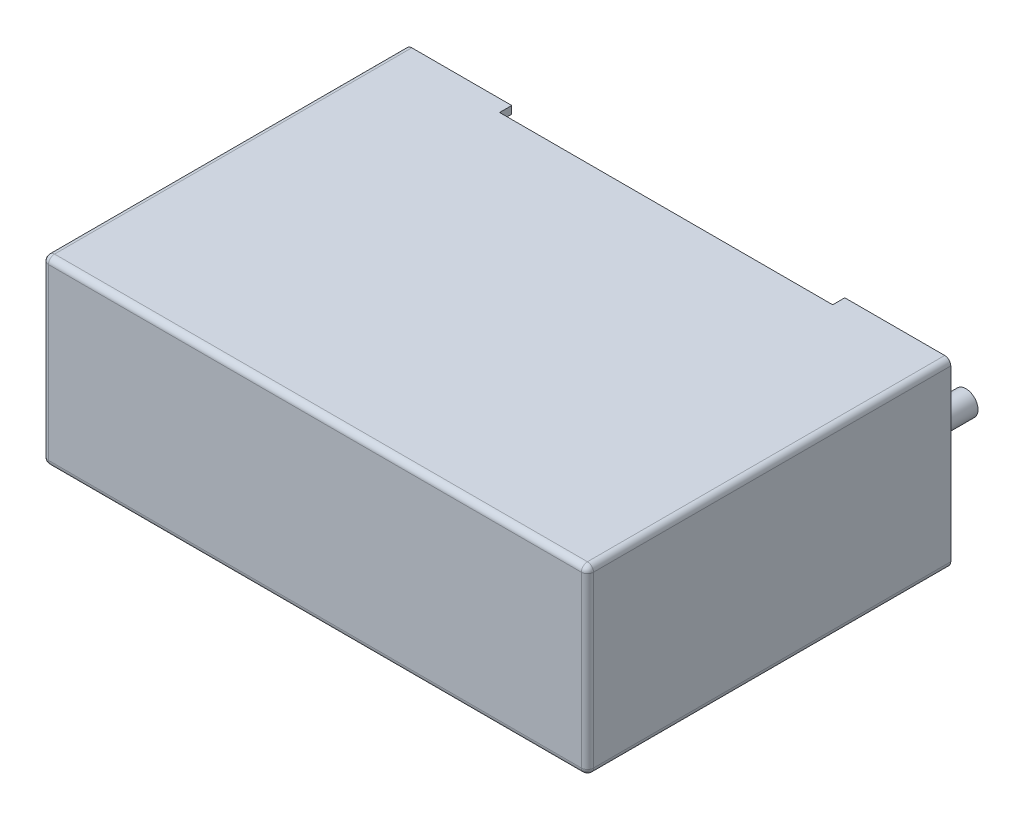
from build123d import *

# Parameters (mm, degrees)
SKETCH1_W               = 18
SKETCH1_H               = 6
EXTRUDE1_DEPTH          = 12
FILLET1_R               = 0.2
BOSS_EXTRUDE1_DEPTH     = 0.01
SKETCH4_W               = 17.5
SKETCH4_H               = 5.5
CUT_EXTRUDE1_DEPTH      = 0.5
CUT_EXTRUDE5_DEPTH      = 17.155494421
CUT_EXTRUDE5_DEPTH_BACK = 6
SKETCH5_W               = 11
SKETCH5_H               = 0.4
SKETCH2_R               = 0.4
EXTRUDE2_DEPTH          = 2.5


with BuildPart() as part:
    # Sketch1 → Extrude1 (new body)
    with BuildSketch(Plane.XY):
        Rectangle(SKETCH1_W, SKETCH1_H)
    extrude(amount=EXTRUDE1_DEPTH)

    # Fillet1
    fillet1_edges = [part.edges().sort_by_distance(p)[0] for p in [
        (9, 0, 12),
        (0, 3, 12),
        (-9, 0, 12),
        (0, -3, 12),
        (-9, 3, 6),
        (9, 3, 6),
        (9, -3, 6),
        (-9, -3, 6),
    ]]
    fillet(fillet1_edges, radius=FILLET1_R)

    # Sketch3 → Boss-Extrude1 (add)
    # profile 1 of 16: a face of its own
    with BuildSketch(Plane.XZ.offset(3)):
        Polygon((-4.080689103, 8.504062122), (-3.871121294, 10.091562122), (-3.85076873, 10.091562122), (-3.195352564, 8.78899802), (-2.541526442, 10.091562122), (-2.520855869, 10.091562122), (-2.310016026, 8.504062122), (-2.453119992, 8.504062122), (-2.605128205, 9.646349782), (-3.178180088, 8.504062122), (-3.210298978, 8.504062122), (-3.785576923, 9.648893853), (-3.937267127, 8.504062122), align=None)
    # profile 2 of 16: a face of its own
    with BuildSketch(Plane.XZ.offset(3)):
        Polygon((-1.984375, 10.091562122), (-1.841907051, 10.091562122), (-1.841907051, 9.487027367), (-1.180130709, 10.091562122), (-0.976923077, 10.091562122), (-1.756998698, 9.379222379), (-0.915865385, 8.504062122), (-1.105716647, 8.504062122), (-1.841907051, 9.270145355), (-1.841907051, 8.504062122), (-1.984375, 8.504062122), align=None)
    # profile 3 of 16: a face of its own
    with BuildSketch(Plane.XZ.offset(3)):
        with BuildLine():
            Line((-0.681810897, 10.091562122), (-0.370480268, 10.091562122))
            add(Edge.make_bspline(
                [(-0.370480268, 10.091562122), (-0.34906675, 10.091538583), (-0.308037499, 10.091493482), (-0.249202455, 10.09012608), (-0.195767327, 10.088299687), (-0.147847333, 10.0857679), (-0.105295031, 10.082775875), (-0.06830297, 10.078579414), (-0.036580386, 10.07419778), (-0.017572818, 10.069743071), (-0.008904247, 10.067711461)],
                knots=[0, 0, 0, 0, 1.415646017, 2.712440637, 3.8905458, 4.950247383, 5.884950622, 6.709939814, 7.411656543, 8, 8, 8, 8], degree=3))
            add(Edge.make_bspline(
                [(-0.008904247, 10.067711461), (0.002069249, 10.064707934), (0.023757664, 10.058771654), (0.055009208, 10.046881858), (0.084742559, 10.032783876), (0.113059731, 10.016716589), (0.139612747, 9.997990636), (0.164797773, 9.977365103), (0.188392549, 9.954363784), (0.210264395, 9.929244663), (0.230350714, 9.902429425), (0.247645249, 9.87351777), (0.262126526, 9.842996358), (0.274546796, 9.810886416), (0.283485988, 9.776918305), (0.290220117, 9.741328047), (0.294494406, 9.704119455), (0.294903782, 9.678692301), (0.295112179, 9.66574832)],
                knots=[0, 0, 0, 0, 0.999701418, 1.975846123, 2.934577507, 3.890451536, 4.834027766, 5.787354733, 6.749476667, 7.726910423, 8.712836071, 9.690891519, 10.682875813, 11.679750201, 12.712814741, 13.765529915, 14.8625177, 16, 16, 16, 16], degree=3))
            add(Edge.make_bspline(
                [(0.295112179, 9.66574832), (0.294921033, 9.652695543), (0.294547043, 9.627156902), (0.290058371, 9.589794959), (0.284012176, 9.554090546), (0.274715299, 9.520122831), (0.262538869, 9.488093535), (0.248254973, 9.457513191), (0.231026729, 9.428902054), (0.211230682, 9.402156254), (0.189209066, 9.377250687), (0.165055054, 9.354365834), (0.138866161, 9.333635652), (0.110725615, 9.315013667), (0.080359077, 9.298931712), (0.0482271, 9.284527506), (0.014050395, 9.272430275), (-0.00959996, 9.26606664), (-0.021624599, 9.262831153)],
                knots=[0, 0, 0, 0, 1.121902311, 2.195077645, 3.232258892, 4.234102512, 5.217864754, 6.176164875, 7.132989551, 8.084763148, 9.034132444, 9.988522005, 10.94243251, 11.903244335, 12.886203696, 13.894208494, 14.929344452, 16, 16, 16, 16], degree=3))
            add(Edge.make_bspline(
                [(-0.021624599, 9.262831153), (-0.031570212, 9.260716158), (-0.053366599, 9.256081023), (-0.089263477, 9.250906473), (-0.131057991, 9.246489776), (-0.178693096, 9.243178188), (-0.232126035, 9.2403432), (-0.291385713, 9.238089814), (-0.356588455, 9.23685163), (-0.402068626, 9.236787771), (-0.425813802, 9.23675443)],
                knots=[0, 0, 0, 0, 0.601384939, 1.31797006, 2.144135048, 3.087295005, 4.142315834, 5.309527816, 6.595305764, 8, 8, 8, 8], degree=3))
            Line((-0.425813802, 9.23675443), (-0.539342949, 9.23675443))
            Line((-0.539342949, 9.23675443), (-0.539342949, 8.504062122))
            Line((-0.539342949, 8.504062122), (-0.681810897, 8.504062122))
            Line((-0.681810897, 8.504062122), (-0.681810897, 10.091562122))
        make_face()
        with BuildLine():
            Line((-0.539342949, 9.928741609), (-0.539342949, 9.399574943))
            Line((-0.539342949, 9.399574943), (-0.261403245, 9.396076846))
            add(Edge.make_bspline(
                [(-0.261403245, 9.396076846), (-0.247832422, 9.396069832), (-0.221634227, 9.396056292), (-0.18378994, 9.397863875), (-0.148679299, 9.399950545), (-0.116410152, 9.403005768), (-0.086967953, 9.407324338), (-0.06030361, 9.411683948), (-0.036623878, 9.417991023), (-0.008911026, 9.426483272), (0.021969636, 9.440966994), (0.055564559, 9.46198998), (0.084035504, 9.488787301), (0.108672731, 9.518917068), (0.128224326, 9.552435602), (0.142537222, 9.588299012), (0.150946962, 9.626139501), (0.152074628, 9.65203305), (0.152644231, 9.665112302)],
                knots=[0, 0, 0, 0, 1.160613943, 2.240541288, 3.23993089, 4.169200891, 5.011653406, 5.7853311, 6.478053781, 7.106038997, 8.262395093, 9.384106736, 10.481365981, 11.59014053, 12.70357646, 13.786202915, 14.881775077, 16, 16, 16, 16], degree=3))
            add(Edge.make_bspline(
                [(0.152644231, 9.665112302), (0.15207153, 9.677875128), (0.150933073, 9.703246046), (0.142471306, 9.74042927), (0.128252153, 9.77591475), (0.108541484, 9.809013256), (0.084619614, 9.839034607), (0.056815983, 9.865113661), (0.02519604, 9.886078505), (-0.004217265, 9.899610029), (-0.030343517, 9.907871957), (-0.053036585, 9.913652653), (-0.078659141, 9.918268017), (-0.107219526, 9.92200522), (-0.138496376, 9.925204469), (-0.172758397, 9.927375251), (-0.2098758, 9.928645912), (-0.235643452, 9.928708938), (-0.249000901, 9.928741609)],
                knots=[0, 0, 0, 0, 1.120700087, 2.227813068, 3.331159281, 4.466773991, 5.599788987, 6.693661531, 7.80175334, 8.91857717, 9.525282508, 10.207424825, 10.974604443, 11.810962634, 12.737642355, 13.736264703, 14.826523623, 16, 16, 16, 16], degree=3))
            Line((-0.249000901, 9.928741609), (-0.539342949, 9.928741609))
        make_face(mode=Mode.SUBTRACT)
    # profile 4 of 16: a face of its own
    with BuildSketch(Plane.XZ.offset(3)):
        Polygon((1.119391026, 10.091562122), (1.283801583, 10.091562122), (1.699439103, 9.442188124), (2.115076623, 10.091562122), (2.279487179, 10.091562122), (1.781803385, 9.313712563), (2.299839744, 8.504062122), (2.135429187, 8.504062122), (1.699439103, 9.185237002), (1.263449018, 8.504062122), (1.099038462, 8.504062122), (1.617392829, 9.313712563), align=None)
    # profile 5 of 16: a face of its own
    with BuildSketch(Plane.XZ.offset(3)):
        with BuildLine():
            Line((2.635657051, 9.603100584), (2.493189103, 9.603100584))
            add(Edge.make_bspline(
                [(2.493189103, 9.603100584), (2.494117633, 9.622001308), (2.495941241, 9.659121827), (2.504481215, 9.713243742), (2.516700827, 9.76497574), (2.533978023, 9.813902451), (2.555434799, 9.860456481), (2.581165918, 9.904452917), (2.611643129, 9.94572392), (2.646208326, 9.983886895), (2.683749816, 10.018896972), (2.724256438, 10.049129886), (2.766821862, 10.074673973), (2.811316946, 10.096028679), (2.858243702, 10.112057823), (2.907176284, 10.12395121), (2.958329678, 10.131106909), (2.993182116, 10.131876069), (3.010907452, 10.13226725)],
                knots=[0, 0, 0, 0, 1.10065271, 2.161652631, 3.183658789, 4.190468796, 5.17591951, 6.163126047, 7.15150782, 8.156236427, 9.156009102, 10.134482811, 11.092018607, 12.041330605, 13.001268258, 13.972401359, 14.968799086, 16, 16, 16, 16], degree=3))
            add(Edge.make_bspline(
                [(3.010907452, 10.13226725), (3.02831465, 10.131859736), (3.062519172, 10.131058985), (3.112440157, 10.124182376), (3.159964144, 10.113412054), (3.204998238, 10.098301133), (3.247183132, 10.077988196), (3.286835727, 10.05358717), (3.324428095, 10.025366032), (3.3582676, 9.992140195), (3.389340908, 9.956669828), (3.416148002, 9.9188021), (3.439104687, 9.87969096), (3.458239813, 9.839038168), (3.47232599, 9.796460952), (3.483020392, 9.752579185), (3.489065326, 9.706938646), (3.489993071, 9.676047458), (3.490464744, 9.66034217)],
                knots=[0, 0, 0, 0, 1.111607364, 2.184268762, 3.212621178, 4.221274766, 5.211760367, 6.196651075, 7.1921475, 8.207485113, 9.220403448, 10.201281604, 11.166441695, 12.114753415, 13.065576456, 14.026450734, 14.996634279, 16, 16, 16, 16], degree=3))
            add(Edge.make_bspline(
                [(3.490464744, 9.66034217), (3.489696728, 9.638231545), (3.488174174, 9.594398305), (3.475150153, 9.529984421), (3.454809057, 9.467575978), (3.430317399, 9.417348701), (3.405610255, 9.376874938), (3.383345564, 9.343551633), (3.357281167, 9.307671652), (3.327037706, 9.269355146), (3.293240796, 9.228301985), (3.255584315, 9.184536971), (3.213799735, 9.138512275), (3.184472487, 9.107077235), (3.169275841, 9.090788384)],
                knots=[0, 0, 0, 0, 1.184426356, 2.348067706, 3.509069118, 4.696110526, 5.333549288, 6.050745305, 6.844228056, 7.710549037, 8.667450064, 9.695053472, 10.805634456, 12, 12, 12, 12], degree=3))
            Line((3.169275841, 9.090788384), (2.772082833, 8.666882635))
            Line((2.772082833, 8.666882635), (3.510817308, 8.666882635))
            Line((3.510817308, 8.666882635), (3.510817308, 8.504062122))
            Line((3.510817308, 8.504062122), (2.43213141, 8.504062122))
            Line((2.43213141, 8.504062122), (3.047796474, 9.161068332))
            add(Edge.make_bspline(
                [(3.047796474, 9.161068332), (3.062786052, 9.176715778), (3.091577962, 9.20677132), (3.132300773, 9.250651163), (3.168876314, 9.29135899), (3.201541346, 9.328817889), (3.229587258, 9.363575779), (3.254475734, 9.394506948), (3.27441727, 9.422970573), (3.29605961, 9.455963637), (3.317020952, 9.496246367), (3.335033342, 9.545474148), (3.346016505, 9.596150437), (3.347334056, 9.630396004), (3.347996795, 9.647621818)],
                knots=[0, 0, 0, 0, 1.329631726, 2.553950428, 3.673215718, 4.687767853, 5.603093632, 6.413772471, 7.123043292, 7.734684054, 8.834405432, 9.900288307, 10.943827018, 12, 12, 12, 12], degree=3))
            add(Edge.make_bspline(
                [(3.347996795, 9.647621818), (3.34770844, 9.658453738), (3.347140149, 9.679801372), (3.342124693, 9.711100413), (3.334545285, 9.74129231), (3.3236844, 9.770469934), (3.309348486, 9.798339926), (3.29189806, 9.824936212), (3.271763996, 9.850648707), (3.248472527, 9.874757524), (3.222885873, 9.896837928), (3.195855624, 9.916397781), (3.167257899, 9.932744092), (3.137213272, 9.946144178), (3.105805505, 9.956655869), (3.072973853, 9.963939582), (3.038809031, 9.968512708), (3.015480267, 9.969131458), (3.003593249, 9.969446738)],
                knots=[0, 0, 0, 0, 0.991446411, 1.95395049, 2.89581595, 3.838931463, 4.798493298, 5.75982156, 6.748411868, 7.785213223, 8.824556874, 9.840280684, 10.836137867, 11.835679398, 12.848801643, 13.863922112, 14.911575587, 16, 16, 16, 16], degree=3))
            add(Edge.make_bspline(
                [(3.003593249, 9.969446738), (2.991178621, 9.969122419), (2.966798342, 9.968485512), (2.931002924, 9.964030232), (2.896855446, 9.956344083), (2.864270012, 9.945831806), (2.833191485, 9.93247025), (2.803771008, 9.915827923), (2.776074626, 9.895968981), (2.750050275, 9.873453443), (2.726072684, 9.848385638), (2.705005708, 9.820441119), (2.686597959, 9.790130113), (2.670537342, 9.757534406), (2.657494583, 9.722358227), (2.64752819, 9.684726447), (2.639642013, 9.644802463), (2.637007434, 9.617232085), (2.635657051, 9.603100584)],
                knots=[0, 0, 0, 0, 1.031018746, 2.02475058, 2.990194455, 3.934040569, 4.864654155, 5.795059489, 6.735614925, 7.690564532, 8.649604399, 9.611025574, 10.590972636, 11.591080095, 12.624614302, 13.701020113, 14.821632451, 16, 16, 16, 16], degree=3))
        make_face()
    # profile 6 of 16: a face of its own
    with BuildSketch(Plane.XZ.offset(3)):
        Polygon((-2.939355469, 6.445728789), (-2.645833333, 6.445728789), (-2.645833333, 4.858228789), (-2.788301282, 4.858228789), (-2.788301282, 6.282908276), (-3.032532051, 6.282908276), align=None)
    # profile 7 of 16: a face of its own
    with BuildSketch(Plane.XZ.offset(3)):
        with BuildLine():
            add(Edge.make_bspline(
                [(-2.055608974, 5.651342771), (-2.055460195, 5.676786943), (-2.055171188, 5.726212615), (-2.051956083, 5.798232792), (-2.046615124, 5.865796923), (-2.039295673, 5.928908242), (-2.030388446, 5.987583042), (-2.01849785, 6.041664522), (-2.004975615, 6.091402986), (-1.989303613, 6.136960629), (-1.971619865, 6.17895123), (-1.952372897, 6.218151232), (-1.930798865, 6.254501323), (-1.908130766, 6.288581678), (-1.883451005, 6.319834425), (-1.85746191, 6.348700919), (-1.829149131, 6.374514009), (-1.799475123, 6.398030011), (-1.768171227, 6.418644592), (-1.736129732, 6.436802299), (-1.703130095, 6.452314382), (-1.669082219, 6.464511115), (-1.63429213, 6.47458532), (-1.598638211, 6.481474593), (-1.562061592, 6.485809334), (-1.537373048, 6.486223747), (-1.524852264, 6.486433917)],
                knots=[0, 0, 0, 0, 1.646270934, 3.197905019, 4.663502075, 6.030701355, 7.308322542, 8.50163776, 9.611534131, 10.641858119, 11.616356847, 12.558055219, 13.465016945, 14.349605745, 15.204443733, 16.039544428, 16.859896111, 17.680448484, 18.487036065, 19.28249412, 20.06191084, 20.843045899, 21.620316918, 22.403196591, 23.190181807, 24, 24, 24, 24], degree=3))
            add(Edge.make_bspline(
                [(-1.524852264, 6.486433917), (-1.512226886, 6.486212658), (-1.487118982, 6.485772643), (-1.449998526, 6.481543569), (-1.413735635, 6.47452631), (-1.378484907, 6.464583582), (-1.343956789, 6.4522484), (-1.310421346, 6.436787458), (-1.277670277, 6.418790257), (-1.24622404, 6.397642999), (-1.215737411, 6.374065324), (-1.186959227, 6.347412256), (-1.159886871, 6.317952919), (-1.134180571, 6.286002502), (-1.11056964, 6.250948196), (-1.088084547, 6.213399689), (-1.06795866, 6.172700332), (-1.048575432, 6.129529192), (-1.031844549, 6.082691746), (-1.01675593, 6.032452016), (-1.004564398, 5.978216581), (-0.994409264, 5.920269998), (-0.986542115, 5.858399461), (-0.980812309, 5.792737597), (-0.977785588, 5.723241205), (-0.977215585, 5.675726038), (-0.976923077, 5.651342771)],
                knots=[0, 0, 0, 0, 0.810914788, 1.612654377, 2.396697861, 3.181598691, 3.963628158, 4.749916497, 5.551656086, 6.361998678, 7.18212741, 8.025565596, 8.878627764, 9.750805457, 10.657531673, 11.591944965, 12.560506719, 13.57287815, 14.630710178, 15.753379473, 16.941251878, 18.199788006, 19.531962791, 20.947069417, 22.433333509, 24, 24, 24, 24], degree=3))
            add(Edge.make_bspline(
                [(-0.976923077, 5.651342771), (-0.977218617, 5.627065856), (-0.977794465, 5.579763276), (-0.980778378, 5.510579584), (-0.986656043, 5.445266186), (-0.994008431, 5.38366644), (-1.004191546, 5.326036734), (-1.016712461, 5.272177645), (-1.030614572, 5.221856584), (-1.047775353, 5.175485795), (-1.066558068, 5.132418406), (-1.086993818, 5.092201521), (-1.108887632, 5.054479667), (-1.132740384, 5.019554782), (-1.158164611, 4.987179462), (-1.185704465, 4.957925183), (-1.214583623, 4.931087057), (-1.245159969, 4.907205783), (-1.277096637, 4.886303032), (-1.309735218, 4.867609607), (-1.343654824, 4.852536207), (-1.378086771, 4.839593527), (-1.413523565, 4.829705465), (-1.449921035, 4.822868395), (-1.487094042, 4.818073307), (-1.512222609, 4.81770751), (-1.524852264, 4.817523661)],
                knots=[0, 0, 0, 0, 1.561518951, 3.042555995, 4.452378317, 5.7783523, 7.031515105, 8.214008947, 9.334062868, 10.386615937, 11.391082383, 12.354592575, 13.286541444, 14.194233754, 15.072674879, 15.931287219, 16.775624067, 17.606195743, 18.42308326, 19.229000347, 20.022332153, 20.807536673, 21.593273796, 22.3848459, 23.188221202, 24, 24, 24, 24], degree=3))
            add(Edge.make_bspline(
                [(-1.524852264, 4.817523661), (-1.537372701, 4.817735186), (-1.56206056, 4.818152273), (-1.598642196, 4.82246743), (-1.634148875, 4.829405033), (-1.66875581, 4.839118993), (-1.702640551, 4.851009294), (-1.735341367, 4.866500429), (-1.767221852, 4.884341239), (-1.79819695, 4.904659162), (-1.827684609, 4.927937211), (-1.855850762, 4.95368387), (-1.881987825, 4.982541632), (-1.906314718, 5.014054833), (-1.929435108, 5.047933553), (-1.950702788, 5.084640351), (-1.970374568, 5.124029678), (-1.988355723, 5.166356016), (-2.004298152, 5.212237001), (-2.018380506, 5.262197522), (-2.029499427, 5.316678542), (-2.039016696, 5.375242491), (-2.046693113, 5.438141024), (-2.051933825, 5.505408287), (-2.055172921, 5.577002364), (-2.055460971, 5.62611044), (-2.055608974, 5.651342771)],
                knots=[0, 0, 0, 0, 0.810891512, 1.598919785, 2.382837074, 3.152667961, 3.926044502, 4.706494248, 5.493654104, 6.291793342, 7.103789334, 7.925228297, 8.761435821, 9.622817696, 10.50288917, 11.416980706, 12.369136599, 13.353924996, 14.394355917, 15.514179734, 16.714354668, 17.994756427, 19.357759367, 20.818452758, 22.365282078, 24, 24, 24, 24], degree=3))
        make_face()
        with BuildLine():
            add(Edge.make_bspline(
                [(-1.913141026, 5.651978789), (-1.913086848, 5.630774915), (-1.912981699, 5.589622359), (-1.91023478, 5.529822022), (-1.90649271, 5.474046195), (-1.901666122, 5.422224055), (-1.894498356, 5.374531014), (-1.886467063, 5.33063905), (-1.876693465, 5.290780446), (-1.865129654, 5.254681689), (-1.851958349, 5.221730147), (-1.837577475, 5.191068168), (-1.822128504, 5.162333539), (-1.804838747, 5.135784367), (-1.7860087, 5.111334071), (-1.766063686, 5.088549894), (-1.744259335, 5.068231263), (-1.714095138, 5.043862296), (-1.674273166, 5.018680404), (-1.624098888, 4.996751999), (-1.572542126, 4.982971384), (-1.537548523, 4.981218895), (-1.520082131, 4.980344173)],
                knots=[0, 0, 0, 0, 1.459021318, 2.831673884, 4.118529203, 5.306027144, 6.411944654, 7.436330062, 8.375795394, 9.233974572, 10.042671642, 10.816086306, 11.563610507, 12.285937304, 12.993564865, 13.685989202, 14.367179055, 15.041617293, 16.353048772, 17.594441528, 18.799311195, 20, 20, 20, 20], degree=3))
            add(Edge.make_bspline(
                [(-1.520082131, 4.980344173), (-1.502502759, 4.981068881), (-1.467380309, 4.9825168), (-1.416066052, 4.996486228), (-1.366250179, 5.017563483), (-1.327210406, 5.042486102), (-1.297509395, 5.066220737), (-1.276229189, 5.086456666), (-1.256697474, 5.109115221), (-1.238172676, 5.133562401), (-1.22118231, 5.160265278), (-1.205732244, 5.189095446), (-1.191633725, 5.220132966), (-1.183601408, 5.241799955), (-1.179494692, 5.252877727)],
                knots=[0, 0, 0, 0, 1.353760809, 2.704726607, 4.075137775, 5.516104923, 6.260822281, 7.007110065, 7.778089737, 8.566572457, 9.372053459, 10.217411131, 11.088608312, 12, 12, 12, 12], degree=3))
            add(Edge.make_bspline(
                [(-1.179494692, 5.252877727), (-1.174708711, 5.267042645), (-1.164991118, 5.295803502), (-1.152467207, 5.340418444), (-1.142604115, 5.387228269), (-1.133730731, 5.435953233), (-1.127674166, 5.486952669), (-1.122799265, 5.540068779), (-1.119927847, 5.595341611), (-1.119571906, 5.632895053), (-1.119391026, 5.651978789)],
                knots=[0, 0, 0, 0, 0.884706709, 1.796334032, 2.740027952, 3.714592787, 4.726048262, 5.777819803, 6.87074269, 8, 8, 8, 8], degree=3))
            add(Edge.make_bspline(
                [(-1.119391026, 5.651978789), (-1.119640576, 5.671059438), (-1.120128749, 5.708385266), (-1.121994736, 5.763048869), (-1.126813286, 5.814968175), (-1.132165029, 5.864366854), (-1.140055912, 5.910971456), (-1.148563917, 5.95517213), (-1.159994467, 5.996421287), (-1.172204508, 6.035364741), (-1.186179223, 6.071560037), (-1.201562431, 6.105175933), (-1.217991586, 6.136374719), (-1.235836102, 6.165070796), (-1.254884144, 6.1913927), (-1.275638461, 6.214812677), (-1.297275801, 6.236056587), (-1.327582168, 6.260305681), (-1.367258007, 6.285030628), (-1.416627282, 6.307784384), (-1.46800361, 6.320851002), (-1.502735141, 6.322693267), (-1.520082131, 6.323613404)],
                knots=[0, 0, 0, 0, 1.31362396, 2.569729283, 3.763502607, 4.902122613, 5.988968491, 7.01645872, 7.998833611, 8.933434873, 9.825090667, 10.667526885, 11.477055099, 12.250526234, 12.991942729, 13.710640831, 14.402115721, 15.076753259, 16.378508321, 17.609869233, 18.806226677, 20, 20, 20, 20], degree=3))
            add(Edge.make_bspline(
                [(-1.520082131, 6.323613404), (-1.53764015, 6.322691998), (-1.572788174, 6.320847507), (-1.624698496, 6.307833067), (-1.674457255, 6.285148615), (-1.714028176, 6.260223789), (-1.744355679, 6.236484626), (-1.765711044, 6.215898627), (-1.785734486, 6.193380505), (-1.804180193, 6.16870535), (-1.821456404, 6.14218713), (-1.837322791, 6.113617226), (-1.851618152, 6.082850857), (-1.864810066, 6.049914117), (-1.876409152, 6.013818474), (-1.885976771, 5.974008967), (-1.894815542, 5.930256609), (-1.901072682, 5.88230526), (-1.906635171, 5.830470141), (-1.910209925, 5.774555071), (-1.912990888, 5.714654442), (-1.913089978, 5.673289109), (-1.913141026, 5.651978789)],
                knots=[0, 0, 0, 0, 1.207732386, 2.417664972, 3.655092373, 4.956220595, 5.625982001, 6.301752483, 6.994047911, 7.697131622, 8.419323945, 9.170223765, 9.943494443, 10.752040957, 11.610060368, 12.549350801, 13.567764191, 14.679664412, 15.874934091, 17.154273443, 18.533957287, 20, 20, 20, 20], degree=3))
        make_face(mode=Mode.SUBTRACT)
    # profile 8 of 16: a face of its own
    with BuildSketch(Plane.XZ.offset(3)):
        with BuildLine():
            add(Edge.make_bspline(
                [(-0.834455128, 5.651342771), (-0.834306349, 5.676786943), (-0.834017342, 5.726212615), (-0.830802237, 5.798232792), (-0.825461278, 5.865796923), (-0.818141827, 5.928908242), (-0.8092346, 5.987583042), (-0.797344004, 6.041664522), (-0.783821769, 6.091402986), (-0.768149766, 6.136960629), (-0.750466019, 6.17895123), (-0.731219051, 6.218151232), (-0.709645019, 6.254501323), (-0.686976919, 6.288581678), (-0.662297158, 6.319834425), (-0.636308064, 6.348700919), (-0.607995285, 6.374514009), (-0.578321277, 6.398030011), (-0.547017381, 6.418644592), (-0.514975886, 6.436802299), (-0.481976249, 6.452314382), (-0.447928373, 6.464511115), (-0.413138284, 6.47458532), (-0.377484365, 6.481474593), (-0.340907746, 6.485809334), (-0.316219202, 6.486223747), (-0.303698417, 6.486433917)],
                knots=[0, 0, 0, 0, 1.646270934, 3.197905019, 4.663502075, 6.030701355, 7.308322542, 8.50163776, 9.611534131, 10.641858119, 11.616356847, 12.558055219, 13.465016945, 14.349605745, 15.204443733, 16.039544428, 16.859896111, 17.680448484, 18.487036065, 19.28249412, 20.06191084, 20.843045899, 21.620316918, 22.403196591, 23.190181807, 24, 24, 24, 24], degree=3))
            add(Edge.make_bspline(
                [(-0.303698417, 6.486433917), (-0.29107304, 6.486212658), (-0.265965136, 6.485772643), (-0.22884468, 6.481543569), (-0.192581788, 6.47452631), (-0.157331061, 6.464583582), (-0.122802942, 6.4522484), (-0.0892675, 6.436787458), (-0.056516431, 6.418790257), (-0.025070194, 6.397642999), (0.005416436, 6.374065324), (0.034194619, 6.347412256), (0.061266976, 6.317952919), (0.086973275, 6.286002502), (0.110584206, 6.250948196), (0.133069299, 6.213399689), (0.153195187, 6.172700332), (0.172578414, 6.129529192), (0.189309297, 6.082691746), (0.204397916, 6.032452016), (0.216589448, 5.978216581), (0.226744582, 5.920269998), (0.234611732, 5.858399461), (0.240341537, 5.792737597), (0.243368258, 5.723241205), (0.243938262, 5.675726038), (0.244230769, 5.651342771)],
                knots=[0, 0, 0, 0, 0.810914788, 1.612654377, 2.396697861, 3.181598691, 3.963628158, 4.749916497, 5.551656086, 6.361998678, 7.18212741, 8.025565596, 8.878627764, 9.750805457, 10.657531673, 11.591944965, 12.560506719, 13.57287815, 14.630710178, 15.753379473, 16.941251878, 18.199788006, 19.531962791, 20.947069417, 22.433333509, 24, 24, 24, 24], degree=3))
            add(Edge.make_bspline(
                [(0.244230769, 5.651342771), (0.243935229, 5.627065856), (0.243359381, 5.579763276), (0.240375468, 5.510579584), (0.234497803, 5.445266186), (0.227145415, 5.38366644), (0.2169623, 5.326036734), (0.204441385, 5.272177645), (0.190539275, 5.221856584), (0.173378493, 5.175485795), (0.154595778, 5.132418406), (0.134160028, 5.092201521), (0.112266214, 5.054479667), (0.088413462, 5.019554782), (0.062989235, 4.987179462), (0.035449381, 4.957925183), (0.006570223, 4.931087057), (-0.024006123, 4.907205783), (-0.055942791, 4.886303032), (-0.088581372, 4.867609607), (-0.122500978, 4.852536207), (-0.156932924, 4.839593527), (-0.192369719, 4.829705465), (-0.228767189, 4.822868395), (-0.265940196, 4.818073307), (-0.291068763, 4.81770751), (-0.303698417, 4.817523661)],
                knots=[0, 0, 0, 0, 1.561518951, 3.042555995, 4.452378317, 5.7783523, 7.031515105, 8.214008947, 9.334062868, 10.386615937, 11.391082383, 12.354592575, 13.286541444, 14.194233754, 15.072674879, 15.931287219, 16.775624067, 17.606195743, 18.42308326, 19.229000347, 20.022332153, 20.807536673, 21.593273796, 22.3848459, 23.188221202, 24, 24, 24, 24], degree=3))
            add(Edge.make_bspline(
                [(-0.303698417, 4.817523661), (-0.316218855, 4.817735186), (-0.340906714, 4.818152273), (-0.377488349, 4.82246743), (-0.412995029, 4.829405033), (-0.447601964, 4.839118993), (-0.481486705, 4.851009294), (-0.514187521, 4.866500429), (-0.546068006, 4.884341239), (-0.577043104, 4.904659162), (-0.606530763, 4.927937211), (-0.634696916, 4.95368387), (-0.660833978, 4.982541632), (-0.685160872, 5.014054833), (-0.708281262, 5.047933553), (-0.729548942, 5.084640351), (-0.749220722, 5.124029678), (-0.767201877, 5.166356016), (-0.783144306, 5.212237001), (-0.79722666, 5.262197522), (-0.808345581, 5.316678542), (-0.81786285, 5.375242491), (-0.825539267, 5.438141024), (-0.830779978, 5.505408287), (-0.834019075, 5.577002364), (-0.834307125, 5.62611044), (-0.834455128, 5.651342771)],
                knots=[0, 0, 0, 0, 0.810891512, 1.598919785, 2.382837074, 3.152667961, 3.926044502, 4.706494248, 5.493654104, 6.291793342, 7.103789334, 7.925228297, 8.761435821, 9.622817696, 10.50288917, 11.416980706, 12.369136599, 13.353924996, 14.394355917, 15.514179734, 16.714354668, 17.994756427, 19.357759367, 20.818452758, 22.365282078, 24, 24, 24, 24], degree=3))
        make_face()
        with BuildLine():
            add(Edge.make_bspline(
                [(-0.691987179, 5.651978789), (-0.691933002, 5.630774915), (-0.691827853, 5.589622359), (-0.689080934, 5.529822022), (-0.685338864, 5.474046195), (-0.680512276, 5.422224055), (-0.67334451, 5.374531014), (-0.665313217, 5.33063905), (-0.655539619, 5.290780446), (-0.643975807, 5.254681689), (-0.630804503, 5.221730147), (-0.616423629, 5.191068168), (-0.600974658, 5.162333539), (-0.583684901, 5.135784367), (-0.564854854, 5.111334071), (-0.54490984, 5.088549894), (-0.523105489, 5.068231263), (-0.492941292, 5.043862296), (-0.453119319, 5.018680404), (-0.402945042, 4.996751999), (-0.35138828, 4.982971384), (-0.316394677, 4.981218895), (-0.298928285, 4.980344173)],
                knots=[0, 0, 0, 0, 1.459021318, 2.831673884, 4.118529203, 5.306027144, 6.411944654, 7.436330062, 8.375795394, 9.233974572, 10.042671642, 10.816086306, 11.563610507, 12.285937304, 12.993564865, 13.685989202, 14.367179055, 15.041617293, 16.353048772, 17.594441528, 18.799311195, 20, 20, 20, 20], degree=3))
            add(Edge.make_bspline(
                [(-0.298928285, 4.980344173), (-0.281348913, 4.981068881), (-0.246226463, 4.9825168), (-0.194912206, 4.996486228), (-0.145096333, 5.017563483), (-0.10605656, 5.042486102), (-0.076355549, 5.066220737), (-0.055075343, 5.086456666), (-0.035543628, 5.109115221), (-0.01701883, 5.133562401), (-2.8464e-05, 5.160265278), (0.015421602, 5.189095446), (0.029520121, 5.220132966), (0.037552438, 5.241799955), (0.041659155, 5.252877727)],
                knots=[0, 0, 0, 0, 1.353760809, 2.704726607, 4.075137775, 5.516104923, 6.260822281, 7.007110065, 7.778089737, 8.566572457, 9.372053459, 10.217411131, 11.088608312, 12, 12, 12, 12], degree=3))
            add(Edge.make_bspline(
                [(0.041659155, 5.252877727), (0.046445135, 5.267042645), (0.056162728, 5.295803502), (0.06868664, 5.340418444), (0.078549731, 5.387228269), (0.087423115, 5.435953233), (0.09347968, 5.486952669), (0.098354581, 5.540068779), (0.101226, 5.595341611), (0.10158194, 5.632895053), (0.101762821, 5.651978789)],
                knots=[0, 0, 0, 0, 0.884706709, 1.796334032, 2.740027952, 3.714592787, 4.726048262, 5.777819803, 6.87074269, 8, 8, 8, 8], degree=3))
            add(Edge.make_bspline(
                [(0.101762821, 5.651978789), (0.10151327, 5.671059438), (0.101025097, 5.708385266), (0.09915911, 5.763048869), (0.09434056, 5.814968175), (0.088988817, 5.864366854), (0.081097934, 5.910971456), (0.072589929, 5.95517213), (0.061159379, 5.996421287), (0.048949338, 6.035364741), (0.034974623, 6.071560037), (0.019591415, 6.105175933), (0.00316226, 6.136374719), (-0.014682256, 6.165070796), (-0.033730298, 6.1913927), (-0.054484615, 6.214812677), (-0.076121955, 6.236056587), (-0.106428322, 6.260305681), (-0.14610416, 6.285030628), (-0.195473436, 6.307784384), (-0.246849764, 6.320851002), (-0.281581295, 6.322693267), (-0.298928285, 6.323613404)],
                knots=[0, 0, 0, 0, 1.31362396, 2.569729283, 3.763502607, 4.902122613, 5.988968491, 7.01645872, 7.998833611, 8.933434873, 9.825090667, 10.667526885, 11.477055099, 12.250526234, 12.991942729, 13.710640831, 14.402115721, 15.076753259, 16.378508321, 17.609869233, 18.806226677, 20, 20, 20, 20], degree=3))
            add(Edge.make_bspline(
                [(-0.298928285, 6.323613404), (-0.316486304, 6.322691998), (-0.351634327, 6.320847507), (-0.40354465, 6.307833067), (-0.453303409, 6.285148615), (-0.49287433, 6.260223789), (-0.523201833, 6.236484626), (-0.544557198, 6.215898627), (-0.56458064, 6.193380505), (-0.583026347, 6.16870535), (-0.600302557, 6.14218713), (-0.616168945, 6.113617226), (-0.630464305, 6.082850857), (-0.64365622, 6.049914117), (-0.655255306, 6.013818474), (-0.664822925, 5.974008967), (-0.673661696, 5.930256609), (-0.679918835, 5.88230526), (-0.685481325, 5.830470141), (-0.689056079, 5.774555071), (-0.691837042, 5.714654442), (-0.691936131, 5.673289109), (-0.691987179, 5.651978789)],
                knots=[0, 0, 0, 0, 1.207732386, 2.417664972, 3.655092373, 4.956220595, 5.625982001, 6.301752483, 6.994047911, 7.697131622, 8.419323945, 9.170223765, 9.943494443, 10.752040957, 11.610060368, 12.549350801, 13.567764191, 14.679664412, 15.874934091, 17.154273443, 18.533957287, 20, 20, 20, 20], degree=3))
        make_face(mode=Mode.SUBTRACT)
    # profile 9 of 16: a face of its own
    with BuildSketch(Plane.XZ.offset(3)):
        with BuildLine():
            Line((0.488461538, 6.018324943), (0.630929487, 6.018324943))
            Line((0.630929487, 6.018324943), (0.630929487, 5.809075143))
            add(Edge.make_bspline(
                [(0.630929487, 5.809075143), (0.6461412, 5.828053807), (0.67566006, 5.864882565), (0.724820097, 5.913287969), (0.776773938, 5.95317741), (0.831203418, 5.984974488), (0.888182426, 6.008944208), (0.947363641, 6.026255184), (1.009101383, 6.036635088), (1.051085967, 6.037991371), (1.072325721, 6.038677507)],
                knots=[0, 0, 0, 0, 1.12780773, 2.188550248, 3.19190651, 4.159438251, 5.104880172, 6.052711206, 7.014878035, 8, 8, 8, 8], degree=3))
            add(Edge.make_bspline(
                [(1.072325721, 6.038677507), (1.093793544, 6.037885936), (1.135811253, 6.036336641), (1.196988088, 6.024082642), (1.25412602, 6.003152473), (1.307021319, 5.974481283), (1.354704019, 5.938827633), (1.396579934, 5.897290568), (1.431216121, 5.84951313), (1.454437782, 5.805188698), (1.469734772, 5.765869138), (1.479365154, 5.732192934), (1.487543492, 5.694674344), (1.494633606, 5.653426744), (1.499431082, 5.608161137), (1.503214907, 5.559063076), (1.505926672, 5.506148467), (1.506034262, 5.469551318), (1.506089744, 5.450679209)],
                knots=[0, 0, 0, 0, 1.235846778, 2.418850247, 3.575807741, 4.728682307, 5.871620074, 6.994088408, 8.11269785, 9.256955736, 9.865816715, 10.540099792, 11.271859618, 12.076849838, 12.949306005, 13.892391288, 14.913166135, 16, 16, 16, 16], degree=3))
            Line((1.506089744, 5.450679209), (1.506089744, 4.858228789))
            Line((1.506089744, 4.858228789), (1.363621795, 4.858228789))
            Line((1.363621795, 4.858228789), (1.363621795, 5.403931914))
            add(Edge.make_bspline(
                [(1.363621795, 5.403931914), (1.363534161, 5.41972638), (1.363366533, 5.449938505), (1.362837829, 5.49319517), (1.361563381, 5.53242301), (1.359772539, 5.567528245), (1.357151336, 5.598477164), (1.354419642, 5.6253328), (1.351079099, 5.648061057), (1.348102349, 5.661743076), (1.346767328, 5.667879229)],
                knots=[0, 0, 0, 0, 1.430800155, 2.736877192, 3.918605307, 4.986035426, 5.920637409, 6.731861385, 7.431261377, 8, 8, 8, 8], degree=3))
            add(Edge.make_bspline(
                [(1.346767328, 5.667879229), (1.34194789, 5.685891088), (1.332671964, 5.720558344), (1.309751193, 5.767582068), (1.280806904, 5.807586246), (1.245474665, 5.840323545), (1.204095763, 5.865801032), (1.156785023, 5.883478504), (1.103998997, 5.894534883), (1.066872188, 5.895635761), (1.047521034, 5.896209558)],
                knots=[0, 0, 0, 0, 1.084156227, 2.086665306, 3.027808233, 3.945421172, 4.874247719, 5.839848303, 6.874090471, 8, 8, 8, 8], degree=3))
            add(Edge.make_bspline(
                [(1.047521034, 5.896209558), (1.036060334, 5.895993656), (1.013379906, 5.895566391), (0.979747598, 5.891279552), (0.947124848, 5.884268039), (0.915184253, 5.874802621), (0.884564647, 5.861802235), (0.854282272, 5.847047842), (0.825477418, 5.828656331), (0.797535877, 5.808159156), (0.771540425, 5.785444659), (0.747352214, 5.761475899), (0.725790327, 5.735950893), (0.706255606, 5.709280917), (0.689392608, 5.68109969), (0.674672814, 5.651679094), (0.66218341, 5.620980405), (0.655977332, 5.59967386), (0.652872095, 5.589013044)],
                knots=[0, 0, 0, 0, 1.023777757, 2.026029729, 3.023749952, 4.003683103, 4.997618607, 5.993177895, 7.010360494, 8.046726602, 9.087585522, 10.09234134, 11.086953743, 12.070360549, 13.043493632, 14.017870808, 15.008233677, 16, 16, 16, 16], degree=3))
            add(Edge.make_bspline(
                [(0.652872095, 5.589013044), (0.651085183, 5.581186577), (0.647195169, 5.564148767), (0.642993656, 5.53618862), (0.63918022, 5.503844452), (0.635988456, 5.467154009), (0.634035642, 5.42598883), (0.631906398, 5.380524717), (0.631131217, 5.330580385), (0.630998613, 5.295808832), (0.630929487, 5.277682415)],
                knots=[0, 0, 0, 0, 0.615963638, 1.340920617, 2.168419149, 3.115676021, 4.16674242, 5.331190069, 6.6087489, 8, 8, 8, 8], degree=3))
            Line((0.630929487, 5.277682415), (0.630929487, 4.858228789))
            Line((0.630929487, 4.858228789), (0.488461538, 4.858228789))
            Line((0.488461538, 4.858228789), (0.488461538, 6.018324943))
        make_face()
    # profile 10 of 16: a face of its own
    with BuildSketch(Plane.XZ.offset(3)):
        Polygon((1.872435897, 6.445728789), (2.645833333, 6.445728789), (2.645833333, 6.282908276), (2.014903846, 6.282908276), (2.014903846, 5.794446738), (2.645833333, 5.794446738), (2.645833333, 5.631626225), (2.014903846, 5.631626225), (2.014903846, 4.858228789), (1.872435897, 4.858228789), align=None)
    # profile 11 of 16: a face of its own
    with BuildSketch(Plane.XZ.offset(3)):
        with BuildLine():
            Line((-4.365625, 2.311433917), (-4.508092949, 2.311433917))
            add(Edge.make_bspline(
                [(-4.508092949, 2.311433917), (-4.507164419, 2.330334641), (-4.50534081, 2.36745516), (-4.496800836, 2.421577075), (-4.484581224, 2.473309073), (-4.467304029, 2.522235784), (-4.445847253, 2.568789814), (-4.420116133, 2.61278625), (-4.389638922, 2.654057253), (-4.355073725, 2.692220229), (-4.317532235, 2.727230306), (-4.277025613, 2.757463219), (-4.23446019, 2.783007306), (-4.189965105, 2.804362012), (-4.14303835, 2.820391156), (-4.094105768, 2.832284543), (-4.042952374, 2.839440243), (-4.008099935, 2.840209403), (-3.990374599, 2.840600584)],
                knots=[0, 0, 0, 0, 1.10065271, 2.161652631, 3.183658789, 4.190468796, 5.17591951, 6.163126047, 7.15150782, 8.156236427, 9.156009102, 10.134482811, 11.092018607, 12.041330605, 13.001268258, 13.972401359, 14.968799086, 16, 16, 16, 16], degree=3))
            add(Edge.make_bspline(
                [(-3.990374599, 2.840600584), (-3.972967401, 2.840193069), (-3.938762879, 2.839392319), (-3.888841894, 2.832515709), (-3.841317907, 2.821745387), (-3.796283813, 2.806634466), (-3.754098919, 2.786321529), (-3.714446324, 2.761920503), (-3.676853957, 2.733699365), (-3.643014451, 2.700473528), (-3.611941144, 2.665003161), (-3.585134049, 2.627135433), (-3.562177365, 2.588024293), (-3.543042238, 2.547371502), (-3.528956061, 2.504794285), (-3.51826166, 2.460912518), (-3.512216725, 2.415271979), (-3.51128898, 2.384380791), (-3.510817308, 2.368675504)],
                knots=[0, 0, 0, 0, 1.111607364, 2.184268762, 3.212621178, 4.221274766, 5.211760367, 6.196651075, 7.1921475, 8.207485113, 9.220403448, 10.201281604, 11.166441695, 12.114753415, 13.065576456, 14.026450734, 14.996634279, 16, 16, 16, 16], degree=3))
            add(Edge.make_bspline(
                [(-3.510817308, 2.368675504), (-3.511585323, 2.346564879), (-3.513107877, 2.302731639), (-3.526131898, 2.238317755), (-3.546472994, 2.175909311), (-3.570964652, 2.125682035), (-3.595671797, 2.085208271), (-3.617936487, 2.051884966), (-3.644000884, 2.016004986), (-3.674244345, 1.977688479), (-3.708041255, 1.936635319), (-3.745697737, 1.892870304), (-3.787482316, 1.846845609), (-3.816809564, 1.815410568), (-3.83200621, 1.799121717)],
                knots=[0, 0, 0, 0, 1.184426356, 2.348067706, 3.509069118, 4.696110526, 5.333549288, 6.050745305, 6.844228056, 7.710549037, 8.667450064, 9.695053472, 10.805634456, 12, 12, 12, 12], degree=3))
            Line((-3.83200621, 1.799121717), (-4.229199219, 1.375215968))
            Line((-4.229199219, 1.375215968), (-3.490464744, 1.375215968))
            Line((-3.490464744, 1.375215968), (-3.490464744, 1.212395455))
            Line((-3.490464744, 1.212395455), (-4.569150641, 1.212395455))
            Line((-4.569150641, 1.212395455), (-3.953485577, 1.869401665))
            add(Edge.make_bspline(
                [(-3.953485577, 1.869401665), (-3.938496, 1.885049112), (-3.90970409, 1.915104653), (-3.868981278, 1.958984496), (-3.832405737, 1.999692323), (-3.799740705, 2.037151222), (-3.771694794, 2.071909112), (-3.746806317, 2.102840281), (-3.726864781, 2.131303907), (-3.705222441, 2.164296971), (-3.684261099, 2.2045797), (-3.666248709, 2.253807481), (-3.655265546, 2.30448377), (-3.653947996, 2.338729337), (-3.653285256, 2.355955151)],
                knots=[0, 0, 0, 0, 1.329631726, 2.553950428, 3.673215718, 4.687767853, 5.603093632, 6.413772471, 7.123043292, 7.734684054, 8.834405432, 9.900288307, 10.943827018, 12, 12, 12, 12], degree=3))
            add(Edge.make_bspline(
                [(-3.653285256, 2.355955151), (-3.653573611, 2.366787071), (-3.654141902, 2.388134705), (-3.659157358, 2.419433746), (-3.666736766, 2.449625644), (-3.677597651, 2.478803267), (-3.691933565, 2.506673259), (-3.709383991, 2.533269545), (-3.729518056, 2.55898204), (-3.752809524, 2.583090857), (-3.778396178, 2.605171261), (-3.805426427, 2.624731114), (-3.834024153, 2.641077425), (-3.86406878, 2.654477512), (-3.895476546, 2.664989202), (-3.928308198, 2.672272915), (-3.96247302, 2.676846042), (-3.985801784, 2.677464791), (-3.997688802, 2.677780071)],
                knots=[0, 0, 0, 0, 0.991446411, 1.95395049, 2.89581595, 3.838931463, 4.798493298, 5.75982156, 6.748411868, 7.785213223, 8.824556874, 9.840280684, 10.836137867, 11.835679398, 12.848801643, 13.863922112, 14.911575587, 16, 16, 16, 16], degree=3))
            add(Edge.make_bspline(
                [(-3.997688802, 2.677780071), (-4.01010343, 2.677455753), (-4.034483709, 2.676818845), (-4.070279127, 2.672363565), (-4.104426605, 2.664677416), (-4.13701204, 2.654165139), (-4.168090566, 2.640803583), (-4.197511043, 2.624161256), (-4.225207425, 2.604302314), (-4.251231777, 2.581786776), (-4.275209367, 2.556718972), (-4.296276343, 2.528774453), (-4.314684092, 2.498463446), (-4.330744709, 2.46586774), (-4.343787468, 2.430691561), (-4.353753862, 2.39305978), (-4.361640038, 2.353135797), (-4.364274617, 2.325565419), (-4.365625, 2.311433917)],
                knots=[0, 0, 0, 0, 1.031018746, 2.02475058, 2.990194455, 3.934040569, 4.864654155, 5.795059489, 6.735614925, 7.690564532, 8.649604399, 9.611025574, 10.590972636, 11.591080095, 12.624614302, 13.701020113, 14.821632451, 16, 16, 16, 16], degree=3))
        make_face()
    # profile 12 of 16: a face of its own
    with BuildSketch(Plane.XZ.offset(3)):
        Polygon((-3.246233974, 2.799895455), (-2.269310897, 2.799895455), (-3.103766026, 1.171690327), (-3.226835437, 1.239426205), (-2.510361579, 2.637074943), (-3.246233974, 2.637074943), align=None)
    # profile 13 of 16: a face of its own
    with BuildSketch(Plane.XZ.offset(3)):
        with BuildLine():
            Line((-1.129567308, 2.799895455), (-1.129567308, 2.637074943))
            Line((-1.129567308, 2.637074943), (-1.669546274, 2.637074943))
            Line((-1.669546274, 2.637074943), (-1.755090645, 2.21952937))
            add(Edge.make_bspline(
                [(-1.755090645, 2.21952937), (-1.738283159, 2.224169529), (-1.705721314, 2.233159103), (-1.657660948, 2.243140292), (-1.612035199, 2.249157118), (-1.582428156, 2.249978677), (-1.568101462, 2.250376225)],
                knots=[0, 0, 0, 0, 1.100273476, 2.13160584, 3.095893838, 4, 4, 4, 4], degree=3))
            add(Edge.make_bspline(
                [(-1.568101462, 2.250376225), (-1.550374195, 2.249992532), (-1.515517957, 2.249238098), (-1.464518864, 2.241993723), (-1.41583573, 2.230590976), (-1.369570369, 2.214661311), (-1.325637191, 2.194291539), (-1.284440404, 2.168846209), (-1.245361636, 2.139122162), (-1.20910196, 2.104947818), (-1.176207006, 2.067336941), (-1.147284575, 2.026897478), (-1.122717971, 1.984022432), (-1.102960057, 1.938302156), (-1.087182877, 1.890242111), (-1.076681794, 1.839336618), (-1.069689215, 1.786065507), (-1.06890799, 1.749641648), (-1.068509615, 1.731067831)],
                knots=[0, 0, 0, 0, 1.052922333, 2.070308379, 3.05430497, 4.020497103, 4.973039431, 5.925935799, 6.892292201, 7.88610001, 8.88166317, 9.857072816, 10.836096531, 11.812156883, 12.81219415, 13.836441305, 14.89672472, 16, 16, 16, 16], degree=3))
            add(Edge.make_bspline(
                [(-1.068509615, 1.731067831), (-1.068811275, 1.718130967), (-1.069410516, 1.692432069), (-1.072457876, 1.654266664), (-1.078325147, 1.616909236), (-1.08620265, 1.58035483), (-1.096427247, 1.54467265), (-1.108804782, 1.509760564), (-1.123952266, 1.475835868), (-1.140567211, 1.442577563), (-1.159275435, 1.410737526), (-1.180039258, 1.380961022), (-1.201976463, 1.352801365), (-1.225580949, 1.326560565), (-1.251072114, 1.302411053), (-1.278141242, 1.280209511), (-1.306572333, 1.259580479), (-1.336805246, 1.241361334), (-1.368166301, 1.224595993), (-1.401108385, 1.210842103), (-1.434881631, 1.198545542), (-1.469972128, 1.188744078), (-1.506300393, 1.181063955), (-1.543926309, 1.175847611), (-1.582652542, 1.172048298), (-1.608902994, 1.171810465), (-1.622162961, 1.171690327)],
                knots=[0, 0, 0, 0, 1.056347294, 2.098418968, 3.122841568, 4.141288669, 5.149314143, 6.15115421, 7.162517403, 8.180376062, 9.185164535, 10.17417709, 11.141909838, 12.097768115, 13.052685741, 14.0056014, 14.954263652, 15.917497458, 16.885230207, 17.854509472, 18.828990115, 19.81800267, 20.826176721, 21.857883937, 22.917946725, 24, 24, 24, 24], degree=3))
            add(Edge.make_bspline(
                [(-1.622162961, 1.171690327), (-1.637980893, 1.172003672), (-1.669100805, 1.17262014), (-1.714694062, 1.179069238), (-1.758561044, 1.188305729), (-1.800348626, 1.202201466), (-1.840431306, 1.219612846), (-1.878269467, 1.241618395), (-1.914829944, 1.266555346), (-1.948626475, 1.29598322), (-1.979993713, 1.328148547), (-2.008072736, 1.363054334), (-2.033079751, 1.400124474), (-2.054614301, 1.439538994), (-2.072983046, 1.481194328), (-2.087413416, 1.525246546), (-2.099060384, 1.571465476), (-2.103987721, 1.603285104), (-2.106490385, 1.619446738)],
                knots=[0, 0, 0, 0, 1.0467383, 2.05933395, 3.04377827, 4.011590433, 4.970194871, 5.932262533, 6.905835911, 7.896367577, 8.894135286, 9.877477877, 10.858688626, 11.851381753, 12.8477658, 13.868841284, 14.917554742, 16, 16, 16, 16], degree=3))
            Line((-2.106490385, 1.619446738), (-1.964022436, 1.619446738))
            add(Edge.make_bspline(
                [(-1.964022436, 1.619446738), (-1.960516983, 1.604308132), (-1.953779308, 1.575210892), (-1.938990272, 1.534329891), (-1.92090825, 1.497899386), (-1.899406992, 1.465437468), (-1.873757514, 1.43713053), (-1.844488809, 1.41190422), (-1.811673948, 1.389146215), (-1.775209876, 1.370176602), (-1.736741087, 1.353998275), (-1.696478817, 1.343225185), (-1.655519345, 1.335650137), (-1.627815942, 1.334891874), (-1.613894732, 1.33451084)],
                knots=[0, 0, 0, 0, 1.136247022, 2.183929868, 3.172523383, 4.106158343, 5.02341133, 5.958108904, 6.928429099, 7.938127109, 8.96079061, 9.975095812, 10.982467395, 12, 12, 12, 12], degree=3))
            add(Edge.make_bspline(
                [(-1.613894732, 1.33451084), (-1.600306437, 1.334883121), (-1.573550974, 1.335616147), (-1.53417581, 1.341258127), (-1.496160684, 1.349947454), (-1.459880705, 1.362951281), (-1.424701006, 1.37875585), (-1.391511475, 1.399037331), (-1.359351956, 1.422378125), (-1.329222052, 1.449119168), (-1.301627016, 1.478587565), (-1.277244776, 1.510100525), (-1.256935247, 1.543717809), (-1.239820133, 1.578857418), (-1.226823816, 1.615904478), (-1.217552371, 1.654685368), (-1.212108126, 1.695295877), (-1.211359198, 1.722995171), (-1.210977564, 1.737109999)],
                knots=[0, 0, 0, 0, 1.027316725, 2.022795036, 3.002884548, 3.971462791, 4.93288096, 5.914575861, 6.907176829, 7.935150275, 8.956128384, 9.956726525, 10.942570165, 11.921478529, 12.907843606, 13.90538589, 14.932640048, 16, 16, 16, 16], degree=3))
            add(Edge.make_bspline(
                [(-1.210977564, 1.737109999), (-1.211276232, 1.749844358), (-1.211860831, 1.774770053), (-1.216637196, 1.811236836), (-1.224945252, 1.845741394), (-1.236476797, 1.87845035), (-1.25111786, 1.909394555), (-1.26900958, 1.938605943), (-1.290487728, 1.965699503), (-1.315022264, 1.990687911), (-1.341900018, 2.013749693), (-1.37158343, 2.033409333), (-1.403451325, 2.049948324), (-1.43711975, 2.064221309), (-1.473389544, 2.074472361), (-1.511542445, 2.082168509), (-1.551990452, 2.086620477), (-1.579645014, 2.087238191), (-1.593860176, 2.087555712)],
                knots=[0, 0, 0, 0, 1.045622112, 2.046656509, 3.013763289, 3.955457236, 4.890082067, 5.820317437, 6.762574623, 7.722996705, 8.69280354, 9.665887285, 10.63943826, 11.638615906, 12.663482002, 13.728887084, 14.832589034, 16, 16, 16, 16], degree=3))
            add(Edge.make_bspline(
                [(-1.593860176, 2.087555712), (-1.606165083, 2.087292372), (-1.631571594, 2.086748643), (-1.670543734, 2.082745196), (-1.711497479, 2.076286659), (-1.75427584, 2.067402897), (-1.799007285, 2.055777373), (-1.845597416, 2.041846153), (-1.894144195, 2.025190103), (-1.926854734, 2.012611564), (-1.943669872, 2.006145455)],
                knots=[0, 0, 0, 0, 0.817624296, 1.688186739, 2.600797293, 3.572016777, 4.590301741, 5.671205678, 6.80286297, 8, 8, 8, 8], degree=3))
            Line((-1.943669872, 2.006145455), (-1.780849359, 2.799895455))
            Line((-1.780849359, 2.799895455), (-1.129567308, 2.799895455))
        make_face()
    # profile 14 of 16: a face of its own
    with BuildSketch(Plane.XZ.offset(3)):
        Polygon((-0.885336538, 2.799895455), (-0.732692308, 2.799895455), (-0.203525641, 1.548848781), (0.325641026, 2.799895455), (0.478285256, 2.799895455), (-0.193349359, 1.212395455), (-0.213701923, 1.212395455), align=None)
    # profile 15 of 16: a face of its own
    with BuildSketch(Plane.XZ.offset(3)):
        Polygon((2.025080128, 2.799895455), (2.757772436, 1.212395455), (2.602902143, 1.212395455), (2.368211639, 1.721209558), (1.648557692, 1.721209558), (1.407189002, 1.212395455), (1.251682692, 1.212395455), (2.004727564, 2.799895455), align=None)
        Polygon((2.013313802, 2.490472879), (1.725833834, 1.884030071), (2.293161558, 1.884030071), align=None, mode=Mode.SUBTRACT)
    # profile 16 of 16: a face of its own
    with BuildSketch(Plane.XZ.offset(3)):
        with BuildLine():
            Line((4.508092949, 2.508599382), (4.383433494, 2.413196738))
            add(Edge.make_bspline(
                [(4.383433494, 2.413196738), (4.374540823, 2.423794874), (4.356875374, 2.444848261), (4.32845495, 2.47441184), (4.29883599, 2.502109298), (4.268029817, 2.528072579), (4.235481931, 2.551393755), (4.201980783, 2.573288148), (4.166965955, 2.592913157), (4.118546419, 2.616708869), (4.055206145, 2.641540161), (3.975470628, 2.662360555), (3.892235237, 2.675614445), (3.835449183, 2.677049927), (3.806565505, 2.677780071)],
                knots=[0, 0, 0, 0, 0.757959112, 1.505699292, 2.245454638, 2.979532153, 3.711538275, 4.438200793, 5.171680507, 5.909471876, 7.393775596, 8.890124382, 10.418191784, 12, 12, 12, 12], degree=3))
            add(Edge.make_bspline(
                [(3.806565505, 2.677780071), (3.790652723, 2.677596845), (3.758974844, 2.677232094), (3.711962858, 2.672420098), (3.665828724, 2.665656799), (3.620602452, 2.655621384), (3.57634161, 2.642933804), (3.532756842, 2.627772991), (3.490479177, 2.609015617), (3.448923761, 2.588283656), (3.409109619, 2.564866922), (3.371438223, 2.539324795), (3.336046966, 2.511943098), (3.302907852, 2.482619203), (3.271987004, 2.451485171), (3.243508474, 2.418209202), (3.217570806, 2.38289768), (3.19365987, 2.346016242), (3.172245523, 2.307672315), (3.154315899, 2.267723979), (3.138438576, 2.226855333), (3.12587499, 2.184604627), (3.115930656, 2.141269159), (3.10906918, 2.096732623), (3.104311909, 2.051088061), (3.103948972, 2.020150266), (3.103766026, 2.004555411)],
                knots=[0, 0, 0, 0, 1.054917814, 2.100044995, 3.131103042, 4.146048494, 5.169673617, 6.183595914, 7.203665975, 8.234915748, 9.262203917, 10.264457458, 11.251630812, 12.227803204, 13.197192746, 14.159520551, 15.12972552, 16.100847026, 17.073214652, 18.039054194, 19.002613845, 19.979014051, 20.95965708, 21.949030935, 22.966165397, 24, 24, 24, 24], degree=3))
            add(Edge.make_bspline(
                [(3.103766026, 2.004555411), (3.104338351, 1.981091563), (3.105462035, 1.935023408), (3.115462529, 1.86754531), (3.130659482, 1.802902004), (3.153435833, 1.741497576), (3.181520545, 1.682574856), (3.217008251, 1.627130805), (3.258109323, 1.574327577), (3.30540522, 1.525413097), (3.35729643, 1.480730086), (3.412971375, 1.441382501), (3.472291392, 1.408582537), (3.534601506, 1.381288447), (3.600381208, 1.360307717), (3.669512207, 1.345537561), (3.741844148, 1.335902714), (3.791269554, 1.334980292), (3.816423778, 1.33451084)],
                knots=[0, 0, 0, 0, 1.029171465, 2.020641659, 2.987623507, 3.938342917, 4.889210282, 5.84687017, 6.821220943, 7.821438502, 8.827599549, 9.822697543, 10.807740252, 11.797342354, 12.80366471, 13.83203677, 14.896651826, 16, 16, 16, 16], degree=3))
            add(Edge.make_bspline(
                [(3.816423778, 1.33451084), (3.844138212, 1.335276822), (3.898686848, 1.336784459), (3.978682345, 1.349556689), (4.055261425, 1.370265816), (4.128428205, 1.399248088), (4.19797642, 1.43692413), (4.264014905, 1.48259781), (4.326599403, 1.536703589), (4.364232806, 1.578016294), (4.383433494, 1.599094173)],
                knots=[0, 0, 0, 0, 1.028121516, 2.023589091, 2.998037872, 3.967518031, 4.937445131, 5.927275754, 6.942489185, 8, 8, 8, 8], degree=3))
            Line((4.383433494, 1.599094173), (4.508092949, 1.504645556))
            add(Edge.make_bspline(
                [(4.508092949, 1.504645556), (4.498060806, 1.491701329), (4.478044574, 1.465874879), (4.445633259, 1.429465924), (4.411489628, 1.395219451), (4.375360074, 1.363411566), (4.337660218, 1.33340579), (4.297713134, 1.306054603), (4.256043965, 1.280976237), (4.212793898, 1.258013311), (4.168008884, 1.237640131), (4.121742587, 1.220198601), (4.074194433, 1.205174097), (4.025362249, 1.192813397), (3.975144745, 1.183165441), (3.923723137, 1.176715803), (3.870986444, 1.172297149), (3.835407656, 1.171894416), (3.817377804, 1.171690327)],
                knots=[0, 0, 0, 0, 0.986787822, 1.968848986, 2.935600012, 3.899624008, 4.868462664, 5.837806735, 6.815139263, 7.798259679, 8.787526145, 9.778297419, 10.776456485, 11.791383307, 12.812564526, 13.85620153, 14.913611965, 16, 16, 16, 16], degree=3))
            add(Edge.make_bspline(
                [(3.817377804, 1.171690327), (3.800303713, 1.17180916), (3.76654181, 1.172044136), (3.716694877, 1.175850583), (3.66816746, 1.181043857), (3.621098254, 1.188863488), (3.575230401, 1.198091099), (3.530979708, 1.210460562), (3.487910737, 1.224316791), (3.446196526, 1.240602267), (3.40580159, 1.25897925), (3.366856219, 1.279748993), (3.329378323, 1.302736838), (3.292999435, 1.327436075), (3.25825696, 1.354640066), (3.224849825, 1.383971004), (3.192590702, 1.41533003), (3.172632341, 1.437942767), (3.162597656, 1.449312022)],
                knots=[0, 0, 0, 0, 1.114604814, 2.203992996, 3.262667896, 4.300477797, 5.318619304, 6.316056647, 7.298880507, 8.271930387, 9.238335007, 10.195173496, 11.151986948, 12.108099108, 13.064862484, 14.031167946, 15.010108607, 16, 16, 16, 16], degree=3))
            add(Edge.make_bspline(
                [(3.162597656, 1.449312022), (3.146525061, 1.469061061), (3.114573912, 1.508320712), (3.073695477, 1.571950425), (3.038703551, 1.63838422), (3.010411615, 1.707971116), (2.988294232, 1.780554967), (2.972972048, 1.856172361), (2.963015427, 1.934752677), (2.961876832, 1.988200078), (2.961298077, 2.015367711)],
                knots=[0, 0, 0, 0, 0.994628077, 1.977248131, 2.950237994, 3.925870899, 4.908910175, 5.911660606, 6.938484602, 8, 8, 8, 8], degree=3))
            add(Edge.make_bspline(
                [(2.961298077, 2.015367711), (2.962003468, 2.043922506), (2.963391282, 2.100102283), (2.975182232, 2.182549754), (2.994150043, 2.261539853), (3.021090775, 2.336925123), (3.05524713, 2.409102071), (3.097441344, 2.477519332), (3.147183227, 2.542614452), (3.204082659, 2.603399714), (3.266479272, 2.658980063), (3.333298877, 2.707877877), (3.404410689, 2.748571179), (3.479031286, 2.782587296), (3.557719434, 2.808733177), (3.640307248, 2.82703623), (3.726639541, 2.838428636), (3.785541427, 2.83986882), (3.815469752, 2.840600584)],
                knots=[0, 0, 0, 0, 1.032925535, 2.032216505, 3.007276963, 3.968222605, 4.92396291, 5.891752235, 6.871517503, 7.883894988, 8.900124299, 9.891468569, 10.874487609, 11.85992873, 12.854644235, 13.869047385, 14.917252991, 16, 16, 16, 16], degree=3))
            add(Edge.make_bspline(
                [(3.815469752, 2.840600584), (3.833709887, 2.8403819), (3.869814398, 2.839949036), (3.923223637, 2.835728036), (3.975222121, 2.828691508), (4.025845674, 2.819113862), (4.075340575, 2.807226969), (4.123328541, 2.791741906), (4.17009116, 2.77403605), (4.215333507, 2.753644175), (4.258838514, 2.730753903), (4.30059263, 2.705618959), (4.340264191, 2.678270505), (4.378132347, 2.648941136), (4.413563629, 2.617010361), (4.447564013, 2.583356451), (4.47897886, 2.547010038), (4.498370487, 2.521426371), (4.508092949, 2.508599382)],
                knots=[0, 0, 0, 0, 1.096760587, 2.17092713, 3.219439832, 4.250915756, 5.268269357, 6.278326846, 7.281116186, 8.274029601, 9.260640565, 10.235837813, 11.203064059, 12.156899882, 13.114053108, 14.069676657, 15.032185724, 16, 16, 16, 16], degree=3))
        make_face()
    extrude(amount=BOSS_EXTRUDE1_DEPTH)

    # Sketch4 → Cut-Extrude1 (cut)
    with BuildSketch(Plane(origin=(0, 0, 0), x_dir=(-1, 0, 0), z_dir=(0, 0, -1))):
        Rectangle(SKETCH4_W, SKETCH4_H)
    extrude(amount=-CUT_EXTRUDE1_DEPTH, mode=Mode.SUBTRACT)

    # Sketch5 → Cut-Extrude5 (cut, two sides: drawn at the far end of the back side and taken through both)
    with BuildSketch(Plane.XZ.offset(3).offset(-CUT_EXTRUDE5_DEPTH_BACK)):
        with Locations((0, 0.2)):
            Rectangle(SKETCH5_W, SKETCH5_H)
    extrude(amount=CUT_EXTRUDE5_DEPTH + CUT_EXTRUDE5_DEPTH_BACK, mode=Mode.SUBTRACT)

    # Sketch2 → Extrude2 (add)
    with BuildSketch(Plane(origin=(0, 0, 0.5), x_dir=(-1, 0, 0), z_dir=(0, 0, -1))):
        with Locations((-7.5, 0)):
            Circle(SKETCH2_R)
        with Locations((7.5, 0)):
            Circle(SKETCH2_R)
    extrude(amount=EXTRUDE2_DEPTH)


solid = part.part
